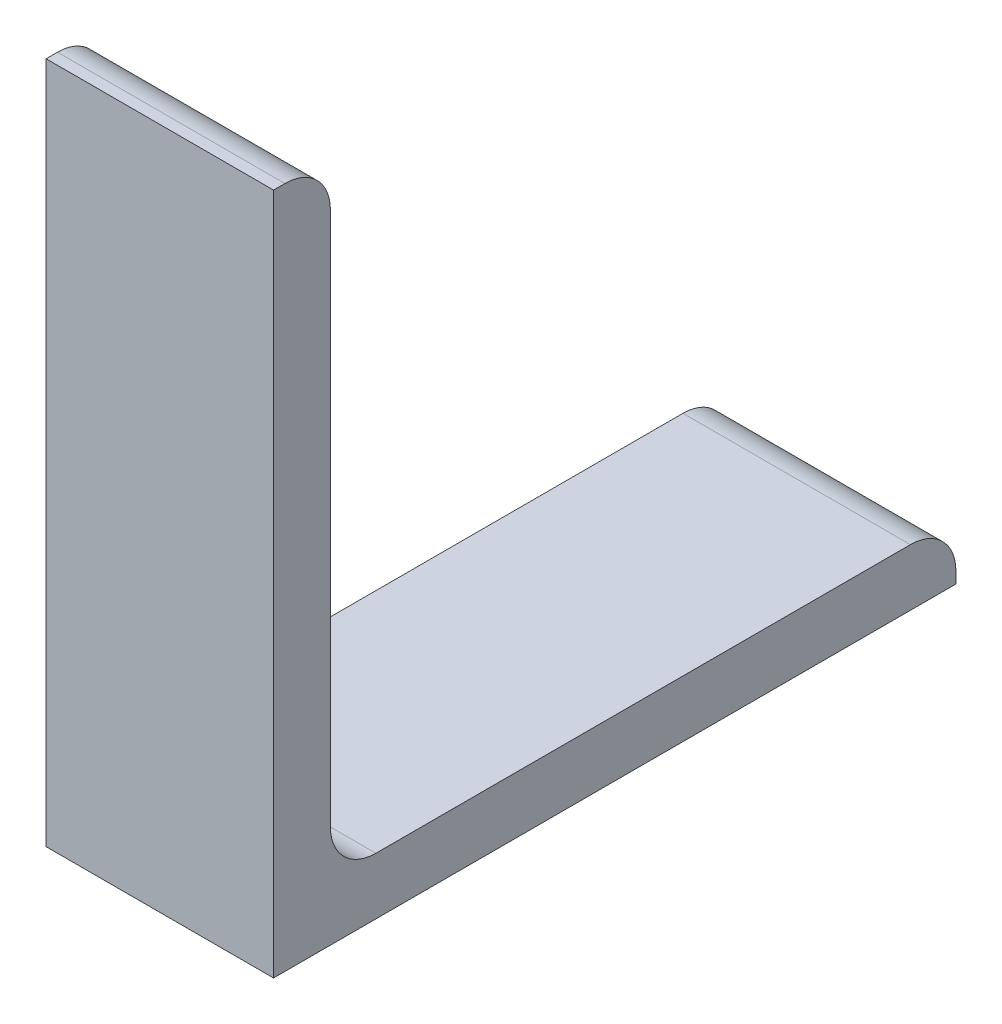
from build123d import *

# Parameters (mm, degrees)
BOSS_EXTRUDE1_DEPTH      = 12.7
BOSS_EXTRUDE1_DEPTH_BACK = 12.7


with BuildPart() as part:
    # Sketch1 → Boss-Extrude1 (new, two sides: drawn at the far end of the back side and taken through both)
    with BuildSketch(Plane(origin=(0, 0, 0), x_dir=(0, 0, -1), z_dir=(1, 0, 0)).offset(-BOSS_EXTRUDE1_DEPTH_BACK)):
        with BuildLine():
            Line((0, 76.2), (0, 0))
            Line((0, 0), (76.2, 0))
            Line((76.2, 0), (76.2, 1.27))
            ThreePointArc((76.2, 1.27), (74.712102448, 4.862102448), (71.12, 6.35))
            Line((71.12, 6.35), (11.43, 6.35))
            ThreePointArc((11.43, 6.35), (7.837897552, 7.837897552), (6.35, 11.43))
            Line((6.35, 11.43), (6.35, 71.12))
            ThreePointArc((6.35, 71.12), (4.862102448, 74.712102448), (1.27, 76.2))
            Line((1.27, 76.2), (0, 76.2))
        make_face()
    extrude(amount=BOSS_EXTRUDE1_DEPTH + BOSS_EXTRUDE1_DEPTH_BACK)


solid = part.part
